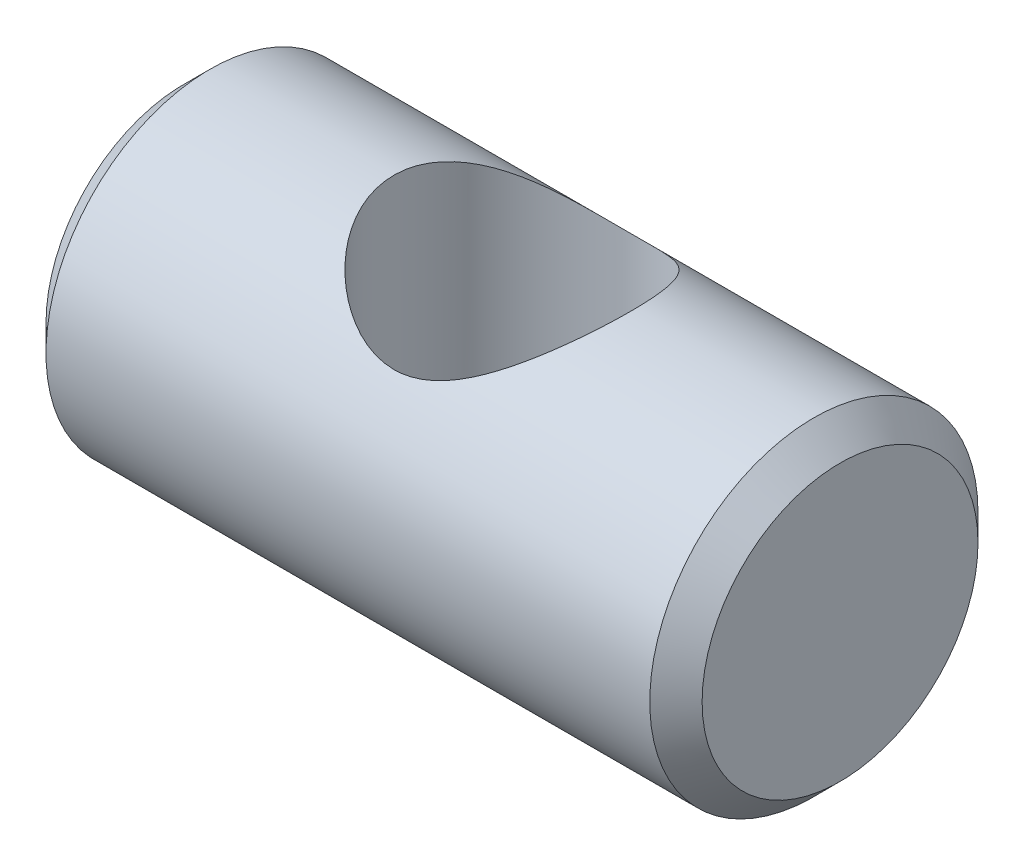
from build123d import *

# Parameters (mm, degrees)
SKETCH1_R               = 4.765
BOSS_EXTRUDE1_DEPTH     = 19.05
CHAMFER1_SIZE           = 0.76
CUT_EXTRUDE1_DEPTH      = 21.206755059
CUT_EXTRUDE1_DEPTH_BACK = 21.206755059
SKETCH2_R               = 3.43


with BuildPart() as part:
    # Sketch1 → Boss-Extrude1 (new body)
    with BuildSketch(Plane(origin=(0, 0, 0), x_dir=(0, 0, -1), z_dir=(1, 0, 0))):
        with Locations(Location((0, 0, 0), (0, 0, 180))):
            Circle(SKETCH1_R)
    extrude(amount=BOSS_EXTRUDE1_DEPTH)

    # Chamfer1
    chamfer1_edges = [part.edges().sort_by_distance(p)[0] for p in [
        (0, 0, -4.765),
        (19.05, 0, -4.765),
    ]]
    chamfer(chamfer1_edges, length=CHAMFER1_SIZE)

    # Sketch2 → Cut-Extrude1 (cut, two sides: drawn at the far end of the back side and taken through both)
    with BuildSketch(Plane(origin=(0, 0, 0), x_dir=(1, 0, 0), z_dir=(0, 1, 0)).offset(-CUT_EXTRUDE1_DEPTH_BACK)):
        with Locations(Location((9.525, 0, 0), (0, 0, 270))):
            Circle(SKETCH2_R)
    extrude(amount=CUT_EXTRUDE1_DEPTH + CUT_EXTRUDE1_DEPTH_BACK, mode=Mode.SUBTRACT)


solid = part.part
